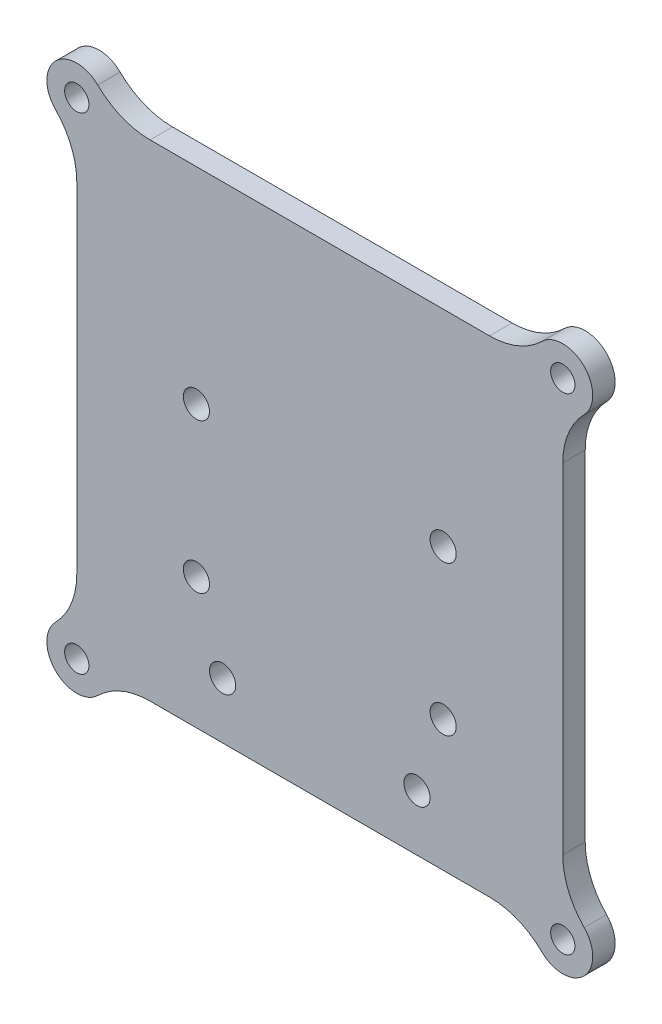
from build123d import *

# Parameters (mm, degrees)
SKETCH_1_R          = 1.625
EXTRUDE_1_DEPTH     = 3
FILLET_1_R          = 10
SKETCH_2_R          = 1.75
CUT_EXTRUDE_1_DEPTH = 10
SKETCH_4_R          = 1.75
CUT_EXTRUDE_2_DEPTH = 10
SKETCH_5_R          = 1.75
CUT_EXTRUDE_3_DEPTH = 10


with BuildPart() as part:
    # Эскиз1 → Бобышка-Вытянуть1 (new body)
    with BuildSketch(Plane.XY):
        with BuildLine():
            ThreePointArc((-32.5, -28.5), (-35.328427125, -35.328427125), (-28.5, -32.5))
            Line((-28.5, -32.5), (28.5, -32.5))
            ThreePointArc((28.5, -32.5), (35.328427125, -35.328427125), (32.5, -28.5))
            Line((32.5, -28.5), (32.5, 28.5))
            ThreePointArc((32.5, 28.5), (35.328427125, 35.328427125), (28.5, 32.5))
            Line((28.5, 32.5), (-28.5, 32.5))
            ThreePointArc((-28.5, 32.5), (-35.328427125, 35.328427125), (-32.5, 28.5))
            Line((-32.5, 28.5), (-32.5, -28.5))
        make_face()
        with Locations((-32.5, -32.5)):
            Circle(SKETCH_1_R, mode=Mode.SUBTRACT)
        with Locations((32.5, 32.5)):
            Circle(SKETCH_1_R, mode=Mode.SUBTRACT)
        with Locations((-32.5, 32.5)):
            Circle(SKETCH_1_R, mode=Mode.SUBTRACT)
        with Locations((32.5, -32.5)):
            Circle(SKETCH_1_R, mode=Mode.SUBTRACT)
    extrude(amount=EXTRUDE_1_DEPTH)

    # Скругление1
    fillet_1_edges = [part.edges().sort_by_distance(p)[0] for p in [
        (-32.5, -28.5, 1.5),
        (-32.5, 28.5, 1.5),
        (-28.5, 32.5, 1.5),
        (28.5, 32.5, 1.5),
        (32.5, 28.5, 1.5),
        (32.5, -28.5, 1.5),
        (28.5, -32.5, 1.5),
        (-28.5, -32.5, 1.5),
    ]]
    fillet(fillet_1_edges, radius=FILLET_1_R)

    # Эскиз2 → Вырез-Вытянуть1 (cut)
    with BuildSketch(Plane.XY.offset(3)):
        with Locations((-13, -25)):
            Circle(SKETCH_2_R)
        with Locations((13, -25)):
            Circle(SKETCH_2_R)
    extrude(amount=-CUT_EXTRUDE_1_DEPTH, mode=Mode.SUBTRACT)

    # Эскиз4 → Вырез-Вытянуть2 (cut)
    with BuildSketch(Plane.XY.offset(3)):
        with Locations((-16.5, -15)):
            Circle(SKETCH_4_R)
        with Locations((16.5, -15)):
            Circle(SKETCH_4_R)
    extrude(amount=-CUT_EXTRUDE_2_DEPTH, mode=Mode.SUBTRACT)

    # Эскиз5 → Вырез-Вытянуть3 (cut)
    with BuildSketch(Plane.XY.offset(3)):
        with Locations((-16.5, 5)):
            Circle(SKETCH_5_R)
        with Locations((16.5, 5)):
            Circle(SKETCH_5_R)
    extrude(amount=-CUT_EXTRUDE_3_DEPTH, mode=Mode.SUBTRACT)


solid = part.part
